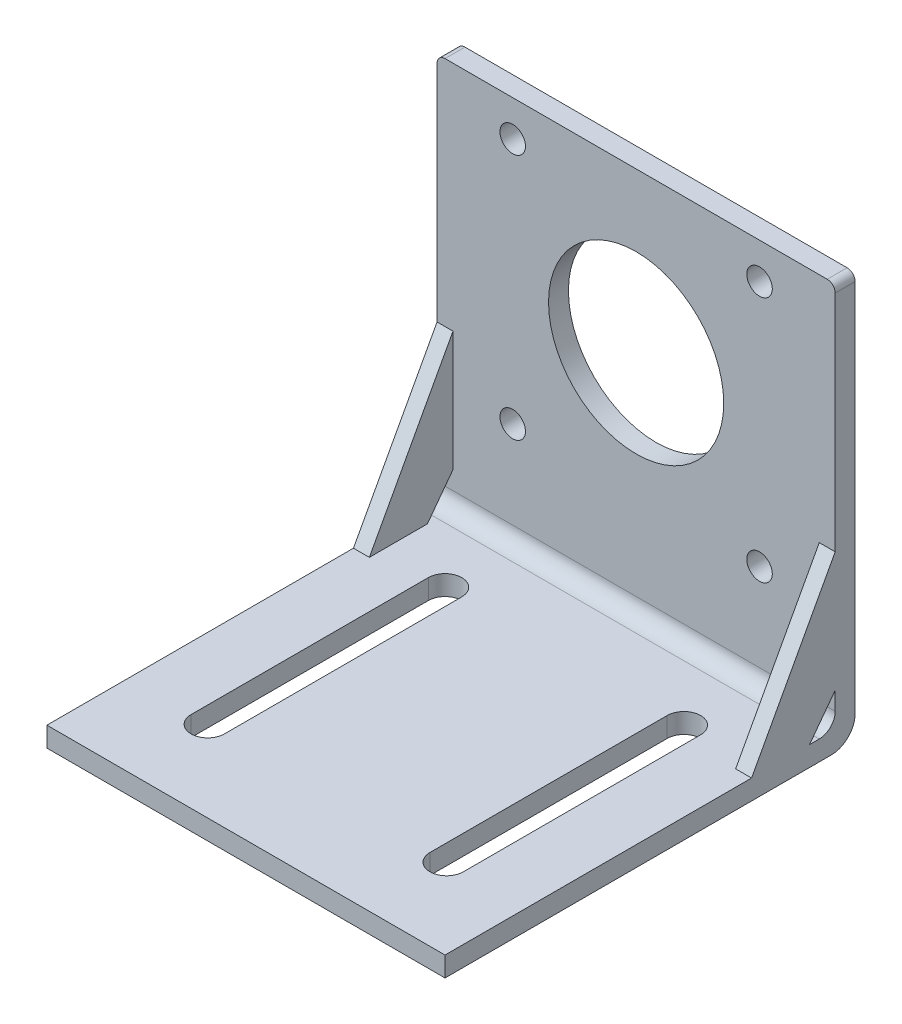
from build123d import *

# Parameters (mm, degrees)
ESQUISSE1_R             = 11
ESQUISSE1_R_2           = 1.6
BOSS_EXTRU_1_DEPTH      = 2.5
ESQUISSE2_W             = 50
ESQUISSE2_H             = 2.5
BOSS_EXTRU_2_DEPTH      = 49
ENL_V_MAT_EXTRU_1_DEPTH = 94.737929077
CONG_1_R                = 3
CONG_2_R                = 2
BOSS_EXTRU_3_DEPTH      = 2


with BuildPart() as part:
    # Esquisse1 → Boss.-Extru.1 (new body)
    with BuildSketch(Plane(origin=(0, 0, 0), x_dir=(-1, 0, 0), z_dir=(0, 0, -1))):
        with BuildLine():
            Line((-11.5004012, -0.849780391), (-11.5004012, 49.150219609))
            ThreePointArc((-11.5004012, 49.150219609), (-11.793294419, 49.85732639), (-12.5004012, 50.150219609))
            Line((-12.5004012, 50.150219609), (-60.5004012, 50.150219609))
            ThreePointArc((-60.5004012, 50.150219609), (-61.207507981, 49.85732639), (-61.5004012, 49.150219609))
            Line((-61.5004012, 49.150219609), (-61.5004012, -0.849780391))
            Line((-61.5004012, -0.849780391), (-11.5004012, -0.849780391))
        make_face()
        with Locations((-36.5004012, 30.150219609)):
            Circle(ESQUISSE1_R, mode=Mode.SUBTRACT)
        with Locations((-52.0004012, 14.650219609)):
            Circle(ESQUISSE1_R_2, mode=Mode.SUBTRACT)
        with Locations((-52.000444233, 45.650219609)):
            Circle(ESQUISSE1_R_2, mode=Mode.SUBTRACT)
        with Locations((-21.0004012, 14.650219609)):
            Circle(ESQUISSE1_R_2, mode=Mode.SUBTRACT)
        with Locations((-21.0004012, 45.650219609)):
            Circle(ESQUISSE1_R_2, mode=Mode.SUBTRACT)
    extrude(amount=-BOSS_EXTRU_1_DEPTH)

    # Esquisse2 → Boss.-Extru.2 (add)
    with BuildSketch(Plane.XY.offset(2.5)):
        with Locations((36.5004012, 0.400219609)):
            Rectangle(ESQUISSE2_W, ESQUISSE2_H)
    extrude(amount=BOSS_EXTRU_2_DEPTH)

    # Esquisse5 → Enlèv. mat.-Extru.1 (cut, through all)
    with BuildSketch(Plane(origin=(0, 1.650219609, 0), x_dir=(1, 0, 0), z_dir=(0, 1, 0))):
        with BuildLine():
            Line((23.6004012, -11.5), (23.6004012, -41.3))
            ThreePointArc((23.6004012, -41.3), (21.5004012, -43.4), (19.4004012, -41.3))
            Line((19.4004012, -41.3), (19.4004012, -11.5))
            ThreePointArc((19.4004012, -11.5), (21.5004012, -9.4), (23.6004012, -11.5))
        make_face()
        with BuildLine():
            Line((49.4004012, -11.5), (49.4004012, -41.3))
            ThreePointArc((49.4004012, -41.3), (51.5004012, -43.4), (53.6004012, -41.3))
            Line((53.6004012, -41.3), (53.6004012, -11.5))
            ThreePointArc((53.6004012, -11.5), (51.5004012, -9.4), (49.4004012, -11.5))
        make_face()
    extrude(amount=-ENL_V_MAT_EXTRU_1_DEPTH, mode=Mode.SUBTRACT)

    # Congé1
    cong_1_edges = [part.edges().sort_by_distance(p)[0] for p in [
        (36.5004012, -0.849780391, 0),
    ]]
    fillet(cong_1_edges, radius=CONG_1_R)

    # Congé2
    cong_2_edges = [part.edges().sort_by_distance(p)[0] for p in [
        (36.5004012, 1.650219609, 2.5),
    ]]
    fillet(cong_2_edges, radius=CONG_2_R)

    # Esquisse4 → Boss.-Extru.3 (add)
    with BuildSketch(Plane.ZY.offset(-11.5004012)):
        Polygon((1.986701053, 6.637130702), (6.116686164, 1.109304476), (13.296506434, 1.109304476), (1.986701053, 21.949844729), align=None)
    boss_extru_3 = extrude(amount=-BOSS_EXTRU_3_DEPTH)

    # Symétrie1: Boss.-Extru.3 across plane
    add(boss_extru_3.mirror(Plane.ZY.offset(-36.5004012)))


solid = part.part
